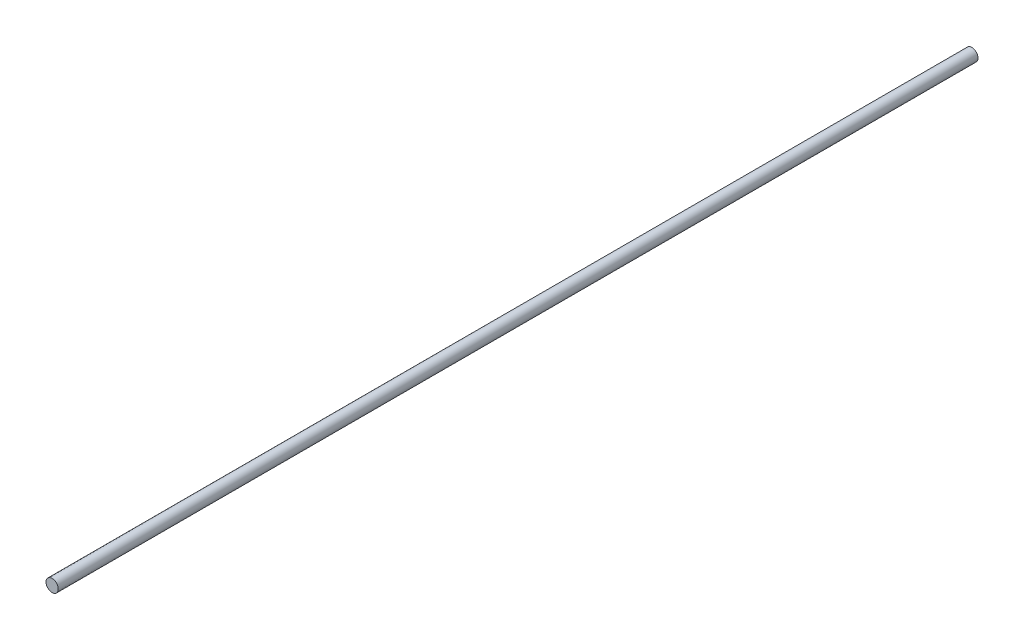
from build123d import *

# Parameters (mm, degrees)
SKETCH_1_R      = 1
EXTRUDE_1_DEPTH = 150


with BuildPart() as part:
    # 草图1 → 凸台-拉伸1 (new body)
    with BuildSketch(Plane.XY):
        Circle(SKETCH_1_R)
    extrude(amount=EXTRUDE_1_DEPTH)


solid = part.part
